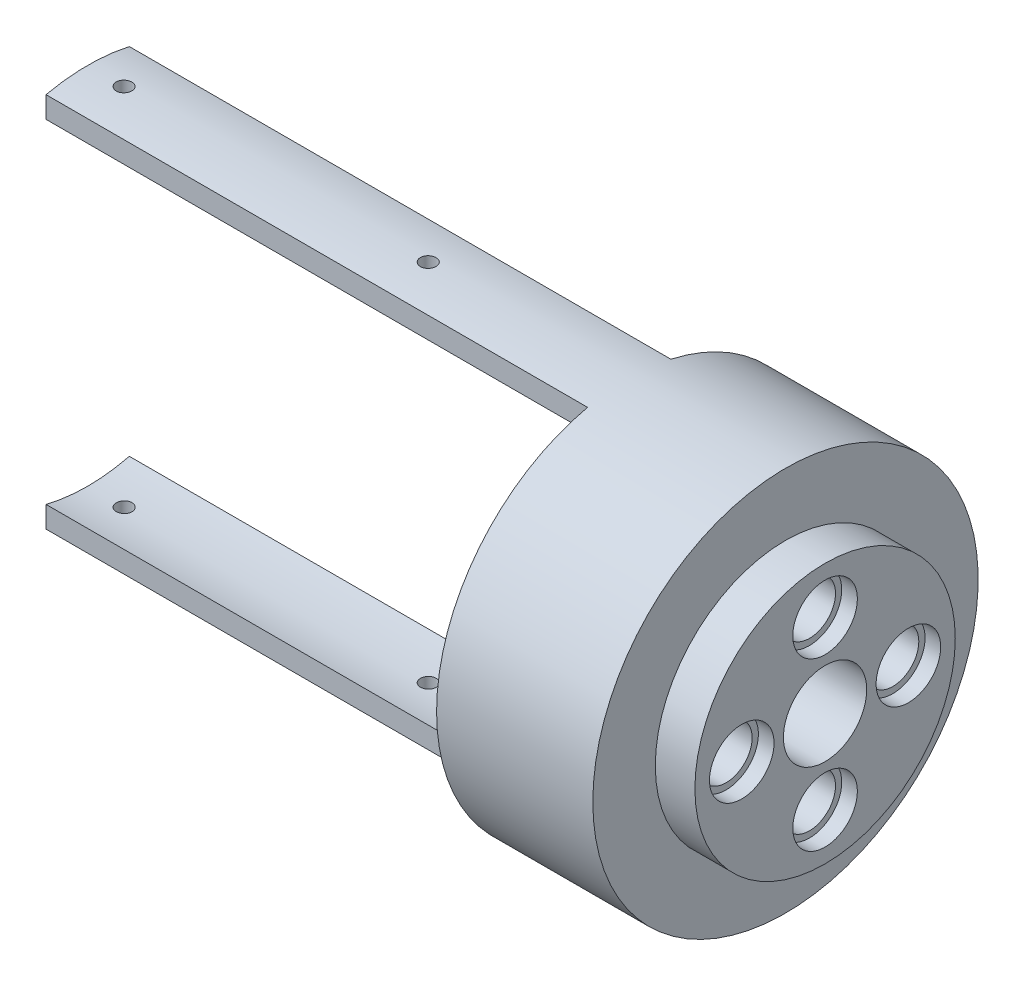
from build123d import *

# Parameters (mm, degrees)
SKETCH_1_R               = 12.5
SKETCH_1_R_2             = 4
SKETCH_1_R_3             = 2.5
EXTRUDE_1_DEPTH          = 7.8
SKETCH_1_3_R             = 3.1
SKETCH_1_3_R_2           = 2.5
CUT_EXTRUDE_1_DEPTH      = 1.5
CUT_EXTRUDE_START        = 6.3
SKETCH_1_4_R             = 3.1
SKETCH_1_4_R_2           = 2.5
CUT_EXTRUDE_2_DEPTH      = 1.5
SKETCH_2_R               = 18.5
SKETCH_2_R_2             = 12.5
EXTRUDE_2_DEPTH          = 4
SKETCH_2_3_R             = 18.5
SKETCH_2_3_R_2           = 16.5
EXTRUDE_3_DEPTH          = 11
EXTRUDE_START            = 63
EXTRUDE_4_DEPTH          = 52
CUT_EXTRUDE_3_DEPTH      = 69.216566903
CUT_EXTRUDE_3_DEPTH_BACK = 69.216566903
SKETCH_5_R               = 0.75


with BuildPart() as part:
    # 草图1 → 凸台-拉伸1 (new body)
    with BuildSketch(Plane(origin=(0, 0, 0), x_dir=(0, 0, -1), z_dir=(1, 0, 0))):
        Circle(SKETCH_1_R)
        Circle(SKETCH_1_R_2, mode=Mode.SUBTRACT)
        with Locations((0, 8)):
            Circle(SKETCH_1_R_3, mode=Mode.SUBTRACT)
        with Locations((8, 0)):
            Circle(SKETCH_1_R_3, mode=Mode.SUBTRACT)
        with Locations((0, -8)):
            Circle(SKETCH_1_R_3, mode=Mode.SUBTRACT)
        with Locations((-8, 0)):
            Circle(SKETCH_1_R_3, mode=Mode.SUBTRACT)
    extrude(amount=EXTRUDE_1_DEPTH)

    # 草图1<3> → 切除-拉伸1 (cut)
    # profile 1 of 4: a face of its own
    with BuildSketch(Plane(origin=(0, 0, 0), x_dir=(0, 0, -1), z_dir=(1, 0, 0))):
        with Locations((0, 8)):
            Circle(SKETCH_1_3_R)
        with Locations((0, 8)):
            Circle(SKETCH_1_3_R_2, mode=Mode.SUBTRACT)
    # profile 2 of 4: a face of its own
    with BuildSketch(Plane(origin=(0, 0, 0), x_dir=(0, 0, -1), z_dir=(1, 0, 0))):
        with Locations((8, 0)):
            Circle(SKETCH_1_3_R)
        with Locations((8, 0)):
            Circle(SKETCH_1_3_R_2, mode=Mode.SUBTRACT)
    # profile 3 of 4: a face of its own
    with BuildSketch(Plane(origin=(0, 0, 0), x_dir=(0, 0, -1), z_dir=(1, 0, 0))):
        with Locations((0, -8)):
            Circle(SKETCH_1_3_R)
        with Locations((0, -8)):
            Circle(SKETCH_1_3_R_2, mode=Mode.SUBTRACT)
    # profile 4 of 4: a face of its own
    with BuildSketch(Plane(origin=(0, 0, 0), x_dir=(0, 0, -1), z_dir=(1, 0, 0))):
        with Locations((-8, 0)):
            Circle(SKETCH_1_3_R)
        with Locations((-8, 0)):
            Circle(SKETCH_1_3_R_2, mode=Mode.SUBTRACT)
    extrude(amount=CUT_EXTRUDE_1_DEPTH, mode=Mode.SUBTRACT)

    # 草图1<4> → 切除-拉伸2 (cut)
    # profile 1 of 4: a face of its own
    with BuildSketch(Plane(origin=(0, 0, 0), x_dir=(0, 0, -1), z_dir=(1, 0, 0)).offset(CUT_EXTRUDE_START)):
        with Locations((0, 8)):
            Circle(SKETCH_1_4_R)
        with Locations((0, 8)):
            Circle(SKETCH_1_4_R_2, mode=Mode.SUBTRACT)
    # profile 2 of 4: a face of its own
    with BuildSketch(Plane(origin=(0, 0, 0), x_dir=(0, 0, -1), z_dir=(1, 0, 0)).offset(CUT_EXTRUDE_START)):
        with Locations((8, 0)):
            Circle(SKETCH_1_4_R)
        with Locations((8, 0)):
            Circle(SKETCH_1_4_R_2, mode=Mode.SUBTRACT)
    # profile 3 of 4: a face of its own
    with BuildSketch(Plane(origin=(0, 0, 0), x_dir=(0, 0, -1), z_dir=(1, 0, 0)).offset(CUT_EXTRUDE_START)):
        with Locations((0, -8)):
            Circle(SKETCH_1_4_R)
        with Locations((0, -8)):
            Circle(SKETCH_1_4_R_2, mode=Mode.SUBTRACT)
    # profile 4 of 4: a face of its own
    with BuildSketch(Plane(origin=(0, 0, 0), x_dir=(0, 0, -1), z_dir=(1, 0, 0)).offset(CUT_EXTRUDE_START)):
        with Locations((-8, 0)):
            Circle(SKETCH_1_4_R)
        with Locations((-8, 0)):
            Circle(SKETCH_1_4_R_2, mode=Mode.SUBTRACT)
    extrude(amount=CUT_EXTRUDE_2_DEPTH, mode=Mode.SUBTRACT)



with BuildPart() as body_2:
    # 草图2 → 凸台-拉伸2 (new body)
    with BuildSketch(Plane.ZY):
        Circle(SKETCH_2_R)
        with Locations(Location((0, 0, 0), (0, 0, 180))):
            Circle(SKETCH_2_R_2, mode=Mode.SUBTRACT)
    extrude(amount=-EXTRUDE_2_DEPTH)


with BuildPart() as part_1:
    add(part.part)

    add(body_2.part)  # 凸台-拉伸3 merges body 2
    # 草图2<3> → 凸台-拉伸3 (add)
    with BuildSketch(Plane.ZY):
        Circle(SKETCH_2_3_R)
        Circle(SKETCH_2_3_R_2, mode=Mode.SUBTRACT)
    extrude(amount=EXTRUDE_3_DEPTH)

    # 草图2<4> → 凸台-拉伸4 (add)
    with BuildSketch(Plane.ZY.offset(EXTRUDE_START)):
        with BuildLine():
            ThreePointArc((-4, -18.062391868), (-2.011933204, -18.390272559), (0, -18.5))
            ThreePointArc((0, -18.5), (2.011933204, -18.390272559), (4, -18.062391868))
            Line((4, -18.062391868), (4, -16.007810594))
            ThreePointArc((4, -16.007810594), (0, -16.5), (-4, -16.007810594))
            Line((-4, -16.007810594), (-4, -18.062391868))
        make_face()
        with BuildLine():
            ThreePointArc((0, 18.5), (-2.011933204, 18.390272559), (-4, 18.062391868))
            Line((-4, 18.062391868), (-4, 16.007810594))
            ThreePointArc((-4, 16.007810594), (0, 16.5), (4, 16.007810594))
            Line((4, 16.007810594), (4, 18.062391868))
            ThreePointArc((4, 18.062391868), (2.011933204, 18.390272559), (0, 18.5))
        make_face()
    extrude(amount=-EXTRUDE_4_DEPTH)

    # 草图5 → 切除-拉伸3 (cut, two sides: drawn at the far end of the back side and taken through both)
    with BuildSketch(Plane(origin=(0, 0, 0), x_dir=(1, 0, 0), z_dir=(0, 1, 0)).offset(-CUT_EXTRUDE_3_DEPTH_BACK)):
        with Locations(Location((-59.5, 0, 0), (0, 0, 270))):
            Circle(SKETCH_5_R)
        with Locations(Location((-30.3, 0, 0), (0, 0, 270))):
            Circle(SKETCH_5_R)
    extrude(amount=CUT_EXTRUDE_3_DEPTH + CUT_EXTRUDE_3_DEPTH_BACK, mode=Mode.SUBTRACT)


solid = part_1.part
